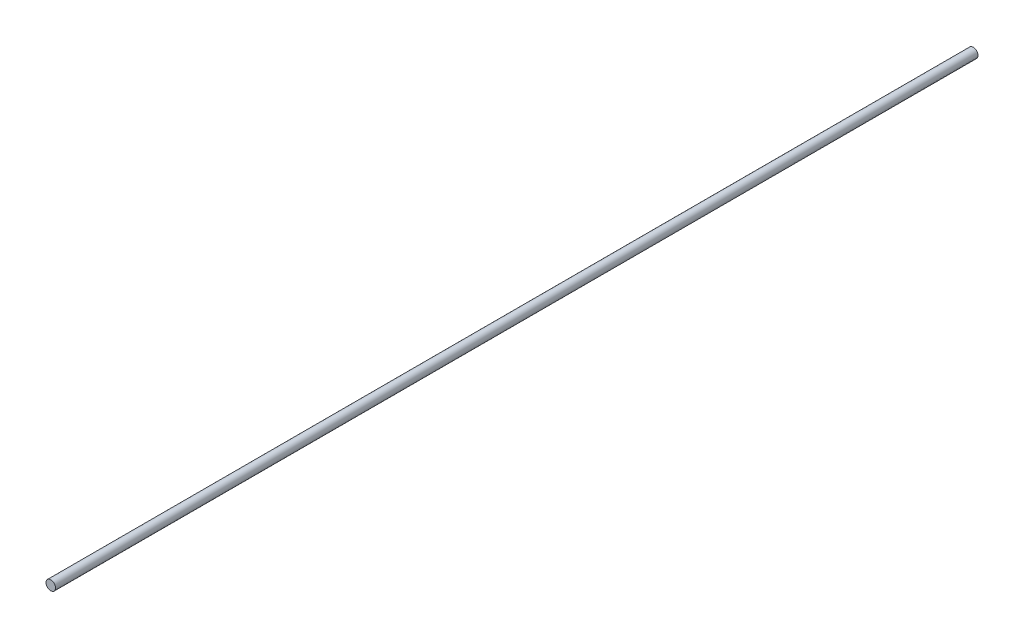
from build123d import *

# Parameters (mm, degrees)
SKETCH_1_R          = 0.4
D0P8_L77_3771_DEPTH = 77.377134347


with BuildPart() as part:
    # 草图1 → D0p8钢索跨度_L77.3771 (new body)
    with BuildSketch(Plane.XY):
        Circle(SKETCH_1_R)
    extrude(amount=D0P8_L77_3771_DEPTH)


solid = part.part
